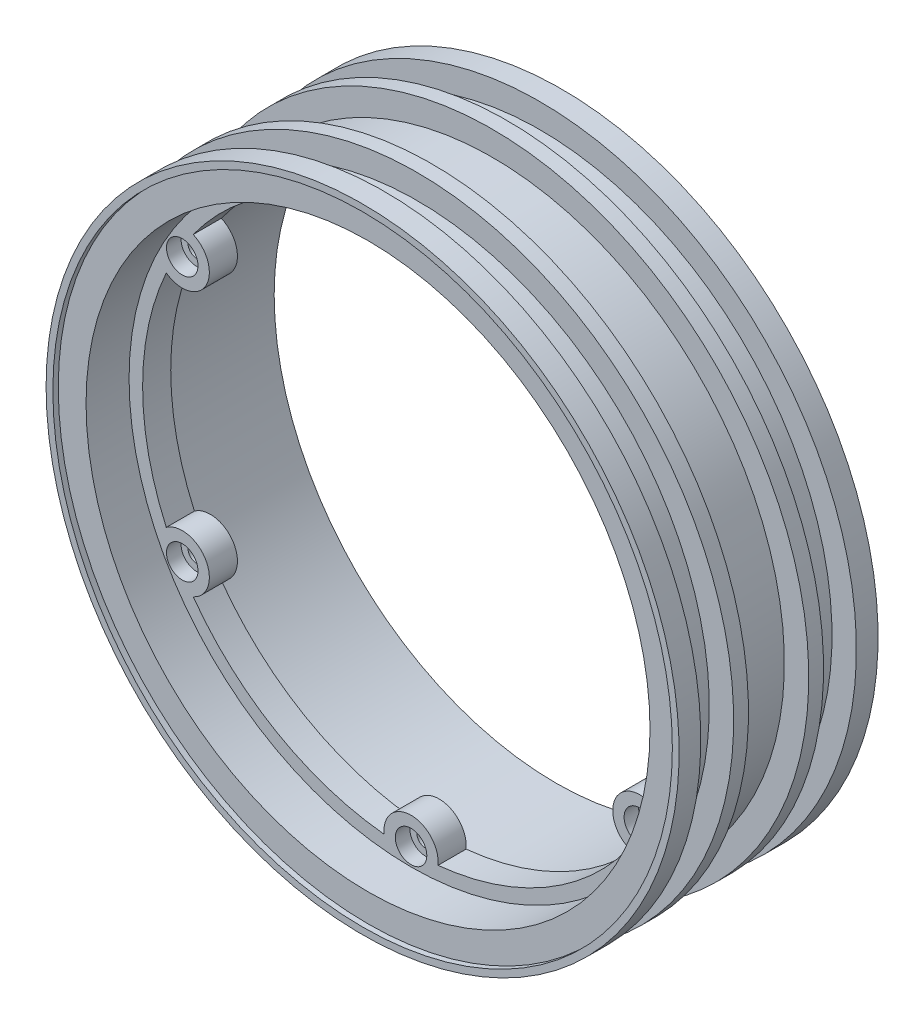
from build123d import *

# Parameters (mm, degrees)
SCHIZZO2_R                   = 41.625
SCHIZZO2_R_2                 = 1.3
ESTRUSIONE_ESTRUSIONE1_DEPTH = 4.15
SCHIZZO3_R                   = 2.325
TAGLIO_ESTRUSIONE1_DEPTH     = 2.15


with BuildPart() as part:
    # Schizzo1 → Rivoluzione1 (revolve)
    with BuildSketch(Plane(origin=(0, 0, 0), x_dir=(0, 0, -1), z_dir=(1, 0, 0)), mode=Mode.PRIVATE) as rivoluzione1_sk:
        Polygon((-13.885, 41.625), (13.885, 41.625), (13.885, 45.725), (14.685, 45.725), (14.685, 46.725), (11.485, 46.725), (11.485, 43.125), (6.635, 43.125), (6.635, 46.725), (4.45, 46.725), (4.45, 43.125), (-4.45, 43.125), (-4.45, 46.725), (-6.635, 46.725), (-6.635, 43.125), (-11.485, 43.125), (-11.485, 46.725), (-14.685, 46.725), (-14.685, 45.725), (-13.885, 45.725), align=None)
    revolve(rivoluzione1_sk.sketch.rotate(Axis((0, 0, 0), (0, 0, 1)), 90), axis=Axis((0, 0, 0), (0, 0, 1)))

    # Schizzo2 → Estrusione-Estrusione1 (add)
    with BuildSketch(Plane.XY.offset(3.385)):
        with Locations(Location((0, 0, 0), (0, 0, 180))):
            Circle(SCHIZZO2_R)
        with Locations(Location((0, 39, 0), (0, 0, 180))):
            Circle(SCHIZZO2_R_2, mode=Mode.SUBTRACT)
        with Locations(Location((33.774990748, 19.5, 0), (0, 0, 180))):
            Circle(SCHIZZO2_R_2, mode=Mode.SUBTRACT)
        with Locations(Location((33.774990748, -19.5, 0), (0, 0, 180))):
            Circle(SCHIZZO2_R_2, mode=Mode.SUBTRACT)
        with Locations(Location((0, -39, 0), (0, 0, 180))):
            Circle(SCHIZZO2_R_2, mode=Mode.SUBTRACT)
        with Locations(Location((-33.774990748, -19.5, 0), (0, 0, 180))):
            Circle(SCHIZZO2_R_2, mode=Mode.SUBTRACT)
        with Locations(Location((-33.774990748, 19.5, 0), (0, 0, 180))):
            Circle(SCHIZZO2_R_2, mode=Mode.SUBTRACT)
        with BuildLine():
            ThreePointArc((-36.131632771, 16.267935896), (-39.625, 0), (-36.131632771, -16.267935896))
            ThreePointArc((-36.131632771, -16.267935896), (-30.310889132, -17.5), (-32.154262138, -23.156943912))
            ThreePointArc((-32.154262138, -23.156943912), (-19.8125, -34.316256625), (-3.977370633, -39.424879808))
            ThreePointArc((-3.977370633, -39.424879808), (0, -35), (3.977370633, -39.424879808))
            ThreePointArc((3.977370633, -39.424879808), (19.8125, -34.316256625), (32.154262138, -23.156943912))
            ThreePointArc((32.154262138, -23.156943912), (30.310889132, -17.5), (36.131632771, -16.267935896))
            ThreePointArc((36.131632771, -16.267935896), (39.625, 0), (36.131632771, 16.267935896))
            ThreePointArc((36.131632771, 16.267935896), (30.310889132, 17.5), (32.154262138, 23.156943912))
            ThreePointArc((32.154262138, 23.156943912), (19.8125, 34.316256625), (3.977370633, 39.424879808))
            ThreePointArc((3.977370633, 39.424879808), (0, 35), (-3.977370633, 39.424879808))
            ThreePointArc((-3.977370633, 39.424879808), (-19.8125, 34.316256625), (-32.154262138, 23.156943912))
            ThreePointArc((-32.154262138, 23.156943912), (-30.310889132, 17.5), (-36.131632771, 16.267935896))
        make_face(mode=Mode.SUBTRACT)
    extrude(amount=ESTRUSIONE_ESTRUSIONE1_DEPTH)

    # Schizzo3 → Taglio-Estrusione1 (cut)
    with BuildSketch(Plane.XY.offset(7.535)):
        with Locations((-33.774990748, -19.5)):
            Circle(SCHIZZO3_R)
        with Locations((-33.774990748, 19.5)):
            Circle(SCHIZZO3_R)
        with Locations((0, 39)):
            Circle(SCHIZZO3_R)
        with Locations((33.774990748, 19.5)):
            Circle(SCHIZZO3_R)
        with Locations((33.774990748, -19.5)):
            Circle(SCHIZZO3_R)
        with Locations((0, -39)):
            Circle(SCHIZZO3_R)
    extrude(amount=-TAGLIO_ESTRUSIONE1_DEPTH, mode=Mode.SUBTRACT)


solid = part.part
